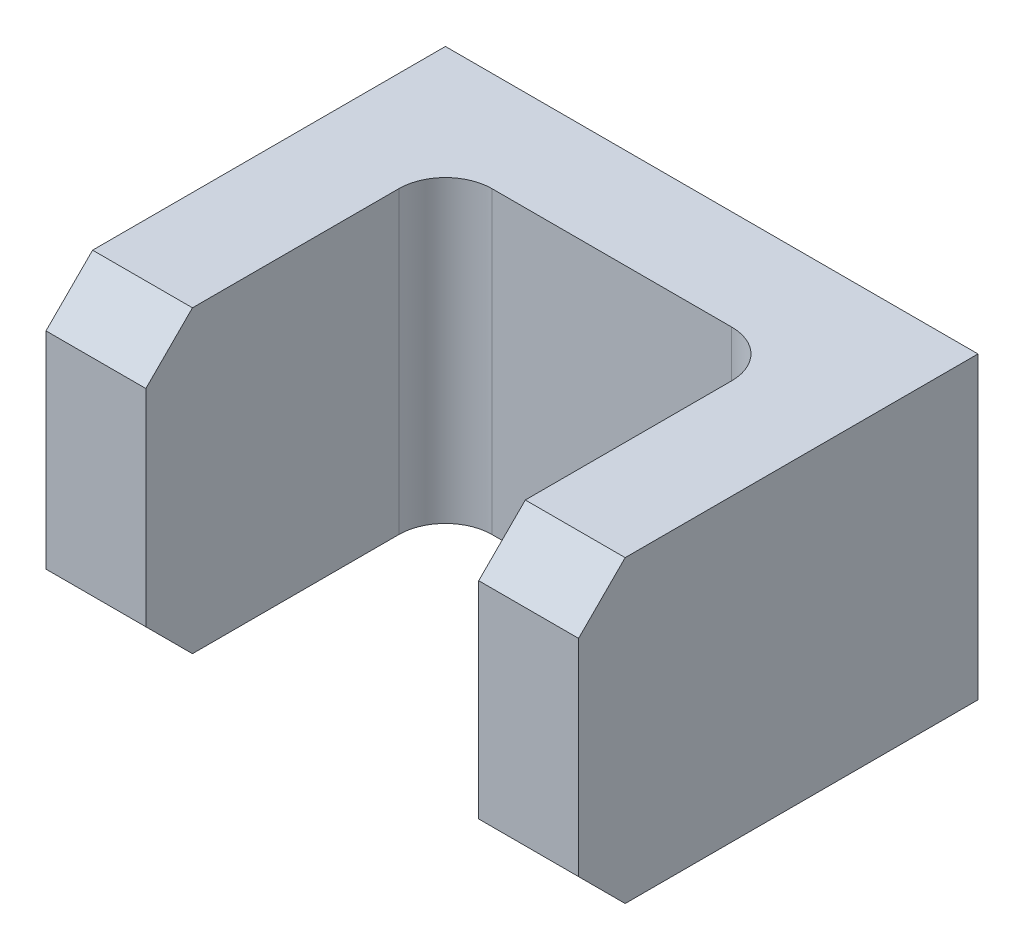
from build123d import *

# Parameters (mm, degrees)
BOSS_EXTRUDE1_DEPTH      = 40
BOSS_EXTRUDE1_DEPTH_BACK = 40
CUT_EXTRUDE1_DEPTH       = 68.268120235
CUT_EXTRUDE1_DEPTH_BACK  = 68.268120235


with BuildPart() as part:
    # Sketch3 → Boss-Extrude1 (new, two sides: drawn at the far end of the back side and taken through both)
    with BuildSketch(Plane(origin=(0, 0, 0), x_dir=(0, 0, -1), z_dir=(1, 0, 0)).offset(-BOSS_EXTRUDE1_DEPTH_BACK)):
        Polygon((-30, -15.5), (-23, -22.5), (30, -22.5), (30, 22.5), (-23, 22.5), (-30, 15.5), align=None)
    extrude(amount=BOSS_EXTRUDE1_DEPTH + BOSS_EXTRUDE1_DEPTH_BACK)

    # Sketch4 → Cut-Extrude1 (cut, two sides: drawn at the far end of the back side and taken through both)
    with BuildSketch(Plane(origin=(0, 22.5, 0), x_dir=(1, 0, 0), z_dir=(0, 1, 0)).offset(-CUT_EXTRUDE1_DEPTH_BACK)):
        with BuildLine():
            Line((18, 15), (-18, 15))
            ThreePointArc((-18, 15), (-22.949747468, 12.949747468), (-25, 8))
            Line((-25, 8), (-25, -30))
            Line((-25, -30), (25, -30))
            Line((25, -30), (25, 8))
            ThreePointArc((25, 8), (22.949747468, 12.949747468), (18, 15))
        make_face()
    extrude(amount=CUT_EXTRUDE1_DEPTH + CUT_EXTRUDE1_DEPTH_BACK, mode=Mode.SUBTRACT)


solid = part.part
